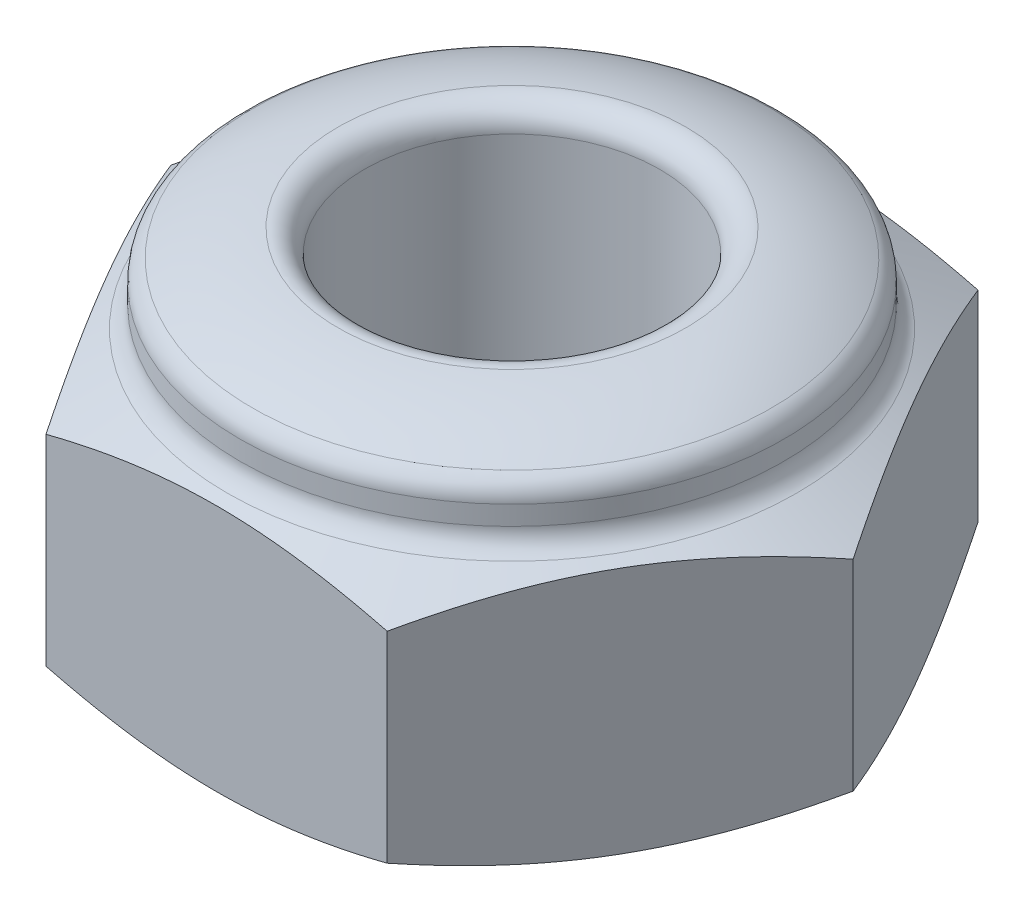
from build123d import *

# Parameters (mm, degrees)
SKETCH_1_R      = 1.25
EXTRUDE_1_DEPTH = 1.15
FILLET_1_R      = 0.2


with BuildPart() as part:
    # 草图1 → 凸台-拉伸1 (new, symmetric)
    with BuildSketch(Plane(origin=(0, 0, 0), x_dir=(1, 0, 0), z_dir=(0, 1, 0))):
        Polygon((2.886751346, 0), (1.443375673, 2.5), (-1.443375673, 2.5), (-2.886751346, 0), (-1.443375673, -2.5), (1.443375673, -2.5), align=None)
        with Locations(Location((0, 0, 0), (0, 0, 270))):
            Circle(SKETCH_1_R, mode=Mode.SUBTRACT)
    extrude(amount=EXTRUDE_1_DEPTH, both=True)

    # 草图2 → 切除-旋转1 (revolve, cut)
    with BuildSketch(Plane.XY, mode=Mode.PRIVATE) as cut_revolve_1_sk:
        Polygon((-2.886751346, 0.85), (-2.3, 1.15), (-2.886751346, 1.15), align=None)
    cut_revolve_1 = revolve(cut_revolve_1_sk.sketch.rotate(Axis((0, 1.15, 0), (0, -1, 0)), 120.00000009), axis=Axis((0, 1.15, 0), (0, -1, 0)), mode=Mode.SUBTRACT)

    # 镜向1: 切除-旋转1 across plane
    add(cut_revolve_1.mirror(Plane.ZX), mode=Mode.SUBTRACT)

    # 草图3 → 旋转1 (revolve)
    with BuildSketch(Plane(origin=(0, 0, 0), x_dir=(0, 0, -1), z_dir=(1, 0, 0))):
        with BuildLine():
            Line((-2.3, 1.15), (-2.3, 1.55))
            ThreePointArc((-2.3, 1.55), (-1.796008242, 1.773528846), (-1.25, 1.85))
            Line((-1.25, 1.85), (-1.25, 1.15))
            Line((-1.25, 1.15), (-2.3, 1.15))
        make_face()
    revolve(axis=Axis((0, 1.15, 0), (0, -1, 0)))

    # 圆角1
    fillet_1_edges = [part.edges().sort_by_distance(p)[0] for p in [
        (2.2216294, 1.15, 0.595283805),
        (0, 1.55, -2.3),
        (0, 1.85, -1.25),
    ]]
    fillet(fillet_1_edges, radius=FILLET_1_R)


solid = part.part
